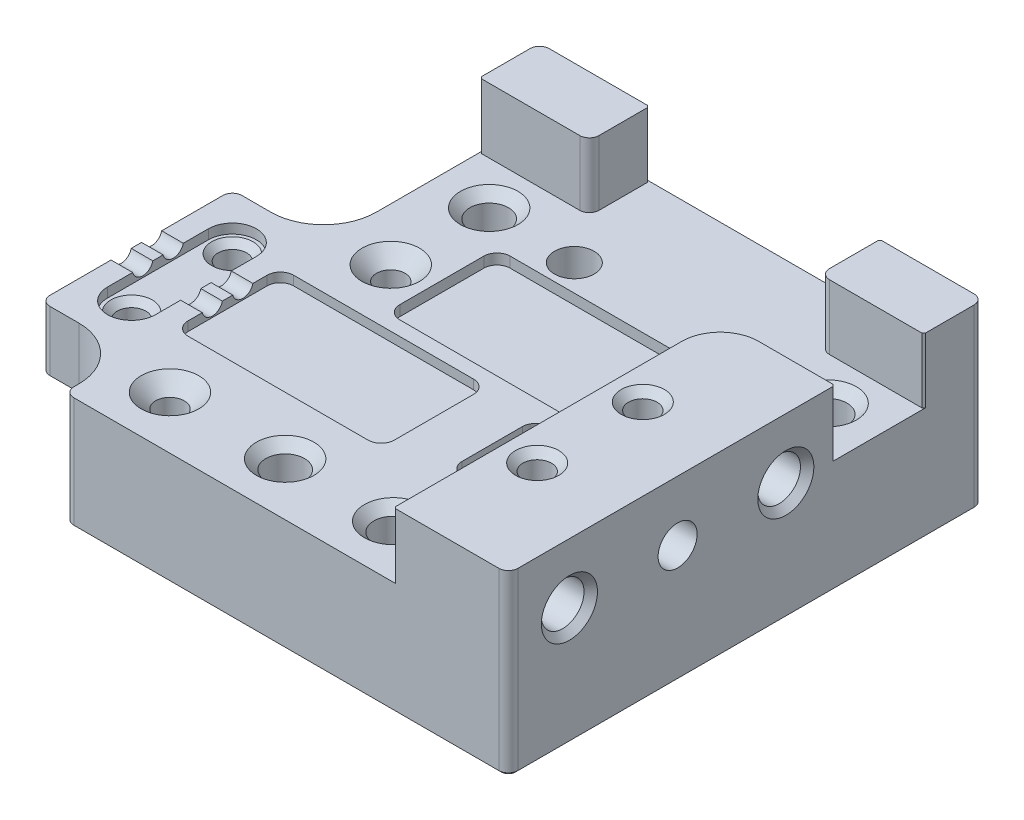
from build123d import *

# Parameters (mm, degrees)
SKETCH1_W                             = 22.3
SKETCH1_H                             = 19.8
BOSS_EXTRUDE1_DEPTH                   = 7.4
CUT_EXTRUDE8_DEPTH                    = 2.7
CUT_EXTRUDE6_DEPTH                    = 19.771652033
CUT_EXTRUDE6_DEPTH_BACK               = 19.771652033
SKETCH9_W                             = 9.6012
SKETCH9_H                             = 16.490065767
SKETCH9_W_2                           = 8.646091416
SKETCH9_H_2                           = 7.298316027
CUT_EXTRUDE2_DEPTH                    = 0.4364
CUT_EXTRUDE3_DEPTH                    = 0.387
CUT_EXTRUDE4_DEPTH                    = 0.387
CE_00_CLAMP_RELIEF_DEPTH              = 0.4
SKETCH50_W                            = 5.437865468
SKETCH50_H                            = 12.843757531
CE_00_CLAMP_UNDERCUT_DEPTH            = 2.2
F_0_80_TAPPED_HOLE_CLAMP_AT_2_COUNT   = 2
F_0_80_TAPPED_HOLE_CLAMP_AT_2_PITCH   = 4.2
F_0_COUNTERBORED_HOLE_D               = 1.651
F_0_COUNTERBORED_HOLE_CBORE_D         = 3
F_0_COUNTERBORED_HOLE_CBORE_DEPTH     = 2
F_0_80_TAPPED_HOLE2_AT_2_COUNT        = 2
F_0_80_TAPPED_HOLE2_AT_2_PITCH        = 9.2
F_52_0_0635_DIAMETER_HOLE2_AT_2_COUNT = 2
F_52_0_0635_DIAMETER_HOLE2_AT_2_PITCH = 4.5
F_0_CLEARANCE_HOLE2_AT_2_COUNT        = 2
F_0_CLEARANCE_HOLE2_AT_2_PITCH        = 14.1
F_0_80_TAPPED_HOLE7_AT_2_COUNT        = 2
F_0_80_TAPPED_HOLE7_AT_2_PITCH        = 4.4
F_2_56_TAPPED_HOLE1_D                 = 1.778
F_2_56_TAPPED_HOLE1_DEPTH             = 4
F_2_56_TAPPED_HOLE1_CSINK_D           = 2.3368
F_2_56_TAPPED_HOLE1_CSINK_ANGLE       = 90
F_2_56_TAPPED_HOLE1_TIP               = 0.53416509
F_1_0_1_DIAMETER_HOLE1_D              = 1
F_1_0_1_DIAMETER_HOLE1_DEPTH          = 5.4
F_1_0_1_DIAMETER_HOLE1_TIP            = 0.30043031
FILLET1_R                             = 0.4
FILLET2_R                             = 0.4
FILLET3_R                             = 2.2
CHAMFER_A_0_10MM_SIZE                 = 0.1
CHAMFER2_SIZE                         = 0.07


with BuildPart() as part:
    # Sketch1 → Boss-Extrude1 (new body)
    with BuildSketch(Plane(origin=(0, 0, 0), x_dir=(1, 0, 0), z_dir=(0, 1, 0))):
        with Locations((-1.5498, 3.1)):
            Rectangle(SKETCH1_W, SKETCH1_H)
    extrude(amount=BOSS_EXTRUDE1_DEPTH)

    # Sketch11 → Cut-Extrude8 (cut)
    with BuildSketch(Plane(origin=(0, 7.4, 0), x_dir=(1, 0, 0), z_dir=(0, 1, 0))):
        with BuildLine():
            Line((4.825, -17.149868936), (4.825, 5.2))
            ThreePointArc((4.825, 5.2), (5.29362915, 6.33137085), (6.425, 6.8))
            Line((6.425, 6.8), (15.917848471, 6.8))
            Line((15.917848471, 6.8), (15.917848471, 10.5))
            Line((15.917848471, 10.5), (5.2758, 10.5))
            Line((5.2758, 10.5), (5.2758, 15.119457422))
            Line((5.2758, 15.119457422), (-4.3254, 15.119457422))
            Line((-4.3254, 15.119457422), (-4.3254, 10.5))
            Line((-4.3254, 10.5), (-17.022656419, 10.5))
            Line((-17.022656419, 10.5), (-17.022656419, 3.556))
            Line((-17.022656419, 3.556), (-14.523625522, 3.556))
            ThreePointArc((-14.523625522, 3.556), (-14.099361454, 3.380264069), (-13.923625522, 2.956))
            Line((-13.923625522, 2.956), (-13.923625522, -7.02))
            ThreePointArc((-13.923625522, -7.02), (-14.099361454, -7.444264069), (-14.523625522, -7.62))
            Line((-14.523625522, -7.62), (-17.022656419, -7.62))
            Line((-17.022656419, -7.62), (-17.022656419, -17.149868936))
            Line((-17.022656419, -17.149868936), (4.825, -17.149868936))
        make_face()
    extrude(amount=-CUT_EXTRUDE8_DEPTH, mode=Mode.SUBTRACT)

    # Sketch9 → Cut-Extrude6 (cut, two sides: drawn at the far end of the back side and taken through both)
    with BuildSketch(Plane(origin=(0, 4.7, 0), x_dir=(1, 0, 0), z_dir=(0, 1, 0)).offset(-CUT_EXTRUDE6_DEPTH_BACK)):
        with Locations((-13.7004, 12.245032884)):
            Rectangle(SKETCH9_W, SKETCH9_H)
        with Locations((-13.222845708, -7.649158014)):
            Rectangle(SKETCH9_W_2, SKETCH9_H_2)
    extrude(amount=CUT_EXTRUDE6_DEPTH + CUT_EXTRUDE6_DEPTH_BACK, mode=Mode.SUBTRACT)

    # Sketch4 → Cut-Extrude2 (cut)
    with BuildSketch(Plane(origin=(0, 4.7, 0), x_dir=(1, 0, 0), z_dir=(0, 1, 0))):
        with BuildLine():
            Line((-5.075, 6.85), (-5.075, 3.35))
            ThreePointArc((-5.075, 3.35), (-4.91390873, 2.96109127), (-4.525, 2.8))
            Line((-4.525, 2.8), (4.275, 2.8))
            ThreePointArc((4.275, 2.8), (4.66390873, 2.96109127), (4.825, 3.35))
            Line((4.825, 3.35), (4.825, 6.85))
            ThreePointArc((4.825, 6.85), (4.66390873, 7.23890873), (4.275, 7.4))
            Line((4.275, 7.4), (-4.525, 7.4))
            ThreePointArc((-4.525, 7.4), (-4.91390873, 7.23890873), (-5.075, 6.85))
        make_face()
    extrude(amount=-CUT_EXTRUDE2_DEPTH, mode=Mode.SUBTRACT)

    # Sketch5 → Cut-Extrude3 (cut)
    with BuildSketch(Plane(origin=(0, 4.7, 0), x_dir=(1, 0, 0), z_dir=(0, 1, 0))):
        with BuildLine():
            Line((-8.35, 2.2), (-0.85, 2.2))
            ThreePointArc((-0.85, 2.2), (-0.46109127, 2.03890873), (-0.3, 1.65))
            Line((-0.3, 1.65), (-0.3, -1.65))
            ThreePointArc((-0.3, -1.65), (-0.46109127, -2.03890873), (-0.85, -2.2))
            Line((-0.85, -2.2), (-8.35, -2.2))
            ThreePointArc((-8.35, -2.2), (-8.73890873, -2.03890873), (-8.9, -1.65))
            Line((-8.9, -1.65), (-8.9, 1.65))
            ThreePointArc((-8.9, 1.65), (-8.73890873, 2.03890873), (-8.35, 2.2))
        make_face()
    extrude(amount=-CUT_EXTRUDE3_DEPTH, mode=Mode.SUBTRACT)

    # Sketch6 → Cut-Extrude4 (cut)
    with BuildSketch(Plane(origin=(0, 4.7, 0), x_dir=(1, 0, 0), z_dir=(0, 1, 0))):
        with BuildLine():
            Line((2.4286, 2.0534), (4.275, 2.0534))
            ThreePointArc((4.275, 2.0534), (4.66390873, 1.89230873), (4.825, 1.5034))
            Line((4.825, 1.5034), (4.825, -1.0034))
            ThreePointArc((4.825, -1.0034), (4.66390873, -1.39230873), (4.275, -1.5534))
            Line((4.275, -1.5534), (2.4286, -1.5534))
            ThreePointArc((2.4286, -1.5534), (2.03969127, -1.39230873), (1.8786, -1.0034))
            Line((1.8786, -1.0034), (1.8786, 1.5034))
            ThreePointArc((1.8786, 1.5034), (2.03969127, 1.89230873), (2.4286, 2.0534))
        make_face()
    extrude(amount=-CUT_EXTRUDE4_DEPTH, mode=Mode.SUBTRACT)

    # Sketch43 → CR-00 Input Coax Revolve (revolve, cut)
    with BuildSketch(Plane.XY.offset(-0.635)):
        with BuildLine():
            Line((-14.315428619, 4.3682), (-8.4998, 4.3682))
            ThreePointArc((-8.4998, 4.3682), (-8.194471292, 4.494671292), (-8.068, 4.8))
            Line((-8.068, 4.8), (-14.315428619, 4.8))
            Line((-14.315428619, 4.8), (-14.315428619, 4.3682))
        make_face()
    cr_00_input_coax_revolve = revolve(axis=Axis((-14.315428619, 4.8, -0.635), (-1, 0, 0)), mode=Mode.SUBTRACT)

    # MI-00 Input Coax Mirror: CR-00 Input Coax Revolve across plane
    add(cr_00_input_coax_revolve.mirror(Plane.XY), mode=Mode.SUBTRACT)

    # Sketch12 → CR-00 Output Hole & Sketch (revolve, cut)
    with BuildSketch(Plane(origin=(0, 4.9, 0), x_dir=(-1, 0, 0), z_dir=(0, 1, 0)), mode=Mode.PRIVATE) as cr_00_output_hole_sketch_sk:
        Polygon((-4.751793584, -0.25), (-11.196934048, -0.25), (-11.196934048, -1.012), (-10.196934048, -1.012), (-10.196934048, -0.9485), (-9.799934048, -0.9485), (-9.799934048, -1.0628), (-4.751793584, -1.0628), align=None)
    revolve(cr_00_output_hole_sketch_sk.sketch.rotate(Axis((11.196934048, 4.9, -0.25), (1, 0, 0)), 180), axis=Axis((11.196934048, 4.9, -0.25), (1, 0, 0)), mode=Mode.SUBTRACT)

    # Sketch46 → CE-00 Clamp Relief (cut)
    with BuildSketch(Plane(origin=(0, 4.7, 0), x_dir=(1, 0, 0), z_dir=(0, 1, 0))):
        with BuildLine():
            Line((-9.7998, -2.1), (-9.7998, 2.1))
            ThreePointArc((-9.7998, 2.1), (-10.7998, 3.1), (-11.7998, 2.1))
            Line((-11.7998, 2.1), (-11.7998, -2.1))
            ThreePointArc((-11.7998, -2.1), (-10.7998, -3.1), (-9.7998, -2.1))
        make_face()
    extrude(amount=-CE_00_CLAMP_RELIEF_DEPTH, mode=Mode.SUBTRACT)

    # Sketch50 → CE-00 Clamp Undercut (cut)
    with BuildSketch(Plane.XZ):
        with Locations((-11.618732734, 0.517149272)):
            Rectangle(SKETCH50_W, SKETCH50_H)
    extrude(amount=-CE_00_CLAMP_UNDERCUT_DEPTH, mode=Mode.SUBTRACT)

    # Sketch40 → #0-80 Tapped Hole Clamp (revolve, cut)
    with BuildSketch(Plane(origin=(-10.7998, 4.3, 2.1), x_dir=(0, 0, 1), z_dir=(1, 0, 0))):
        Polygon((0, 0), (0, 2.1), (1.000000032, 2.1), (0.59563, 1.695629968), (0.59563, 0.26797), (0.8636, 0), align=None)
    f_0_80_tapped_hole_clamp = revolve(axis=Axis((-10.7998, 10.65, 2.1), (0, -1, 0)), mode=Mode.SUBTRACT)

    # #0-80 Tapped Hole Clamp at 2: #0-80 Tapped Hole Clamp ×2
    with Locations(*[(0, 0, -i * F_0_80_TAPPED_HOLE_CLAMP_AT_2_PITCH) for i in range(1, F_0_80_TAPPED_HOLE_CLAMP_AT_2_COUNT)]):
        add(f_0_80_tapped_hole_clamp, mode=Mode.SUBTRACT)

    # #0 Counterbored Hole (through all)
    with Locations(Plane(origin=(3.077088049, 0, 3.306534169), x_dir=(1, 0, 0), z_dir=(0, -1, 0))):
        with Locations((0.827111951, -11.806534169), (-6.030888049, -11.806534169)):
            CounterBoreHole(F_0_COUNTERBORED_HOLE_D / 2, F_0_COUNTERBORED_HOLE_CBORE_D / 2, F_0_COUNTERBORED_HOLE_CBORE_DEPTH)

    # Sketch17 → #0-80 Tapped Hole2 (revolve, cut)
    with BuildSketch(Plane(origin=(-6.6998, 4.7, -4.6), x_dir=(0, 0, 1), z_dir=(1, 0, 0))):
        Polygon((0, 0), (0, 4.7), (1.000000032, 4.7), (0.59563, 4.295629968), (0.59563, 0.604370013), (1.200000013, 0), align=None)
    f_0_80_tapped_hole2 = revolve(axis=Axis((-6.6998, 11.05, -4.6), (0, -1, 0)), mode=Mode.SUBTRACT)

    # #0-80 Tapped Hole2 at 2: #0-80 Tapped Hole2 ×2
    with Locations(*[(0, 0, i * F_0_80_TAPPED_HOLE2_AT_2_PITCH) for i in range(1, F_0_80_TAPPED_HOLE2_AT_2_COUNT)]):
        add(f_0_80_tapped_hole2, mode=Mode.SUBTRACT)

    # Sketch19 → #52 (0.0635) Diameter Hole2 (revolve, cut)
    with BuildSketch(Plane(origin=(2.6002, 4.7, 4.6), x_dir=(0, 0, 1), z_dir=(1, 0, 0))):
        Polygon((0, 0), (0, 4.7), (1.000000032, 4.7), (0.80645, 4.506449968), (0.80645, 0.393550013), (1.200000013, 0), align=None)
    f_52_0_0635_diameter_hole2 = revolve(axis=Axis((2.6002, 11.05, 4.6), (0, -1, 0)), mode=Mode.SUBTRACT)

    # #52 (0.0635) Diameter Hole2 at 2: #52 (0.0635) Diameter Hole2 ×2
    with Locations(*[(-i * F_52_0_0635_DIAMETER_HOLE2_AT_2_PITCH, 0, 0) for i in range(1, F_52_0_0635_DIAMETER_HOLE2_AT_2_COUNT)]):
        add(f_52_0_0635_diameter_hole2, mode=Mode.SUBTRACT)

    # Sketch21 → #0 Clearance Hole2 (revolve, cut)
    with BuildSketch(Plane(origin=(7.4002, 4.7, -8.7), x_dir=(0, 0, 1), z_dir=(1, 0, 0))):
        Polygon((0, 0), (0, 4.7), (1.000000032, 4.7), (0.80645, 4.506449968), (0.80645, 0.393550013), (1.200000013, 0), align=None)
    f_0_clearance_hole2 = revolve(axis=Axis((7.4002, 11.05, -8.7), (0, -1, 0)), mode=Mode.SUBTRACT)

    # #0 Clearance Hole2 at 2: #0 Clearance Hole2 ×2
    with Locations(*[(-i * F_0_CLEARANCE_HOLE2_AT_2_PITCH, 0, 0) for i in range(1, F_0_CLEARANCE_HOLE2_AT_2_COUNT)]):
        add(f_0_clearance_hole2, mode=Mode.SUBTRACT)

    # Sketch28 → #0-80 Tapped Hole7 (revolve, cut)
    with BuildSketch(Plane(origin=(6.2002, 7.4, 2.2), x_dir=(0, 0, 1), z_dir=(1, 0, 0))):
        Polygon((0, 0), (0, 7.4), (1.000000032, 7.4), (0.59563, 6.995629968), (0.59563, 0.304369978), (0.899999978, 0), align=None)
    f_0_80_tapped_hole7 = revolve(axis=Axis((6.2002, 13.75, 2.2), (0, -1, 0)), mode=Mode.SUBTRACT)

    # #0-80 Tapped Hole7 at 2: #0-80 Tapped Hole7 ×2
    with Locations(*[(0, 0, -i * F_0_80_TAPPED_HOLE7_AT_2_PITCH) for i in range(1, F_0_80_TAPPED_HOLE7_AT_2_COUNT)]):
        add(f_0_80_tapped_hole7, mode=Mode.SUBTRACT)

    # #2-56 Tapped Hole1
    with Locations(Plane(origin=(9.6002, 0, 0), x_dir=(0, 0, -1), z_dir=(1, 0, 0))):
        with Locations((4.7585, 4.9), (-4.2585, 4.9)):
            CounterSinkHole(F_2_56_TAPPED_HOLE1_D / 2, F_2_56_TAPPED_HOLE1_CSINK_D / 2, depth=F_2_56_TAPPED_HOLE1_DEPTH, counter_sink_angle=F_2_56_TAPPED_HOLE1_CSINK_ANGLE)
            with Locations((0, 0, -(F_2_56_TAPPED_HOLE1_DEPTH + F_2_56_TAPPED_HOLE1_TIP / 2))):  # 118° drill point
                Cone(0, F_2_56_TAPPED_HOLE1_D / 2, F_2_56_TAPPED_HOLE1_TIP, mode=Mode.SUBTRACT)

    # Ø1.0 (1) Diameter Hole1
    with Locations(Plane(origin=(9.6002, 0, 0), x_dir=(0, 0, -1), z_dir=(1, 0, 0))):
        with Locations((4.7585, 4.9), (-4.2585, 4.9)):
            Hole(F_1_0_1_DIAMETER_HOLE1_D / 2, depth=F_1_0_1_DIAMETER_HOLE1_DEPTH)
            with Locations((0, 0, -(F_1_0_1_DIAMETER_HOLE1_DEPTH + F_1_0_1_DIAMETER_HOLE1_TIP / 2))):  # 118° drill point
                Cone(0, F_1_0_1_DIAMETER_HOLE1_D / 2, F_1_0_1_DIAMETER_HOLE1_TIP, mode=Mode.SUBTRACT)

    # Fillet1
    fillet1_edges = [part.edges().sort_by_distance(p)[0] for p in [
        (-12.6998, 3.45, 4),
        (-12.6998, 3.45, -4),
    ]]
    fillet(fillet1_edges, radius=FILLET1_R)

    # Fillet2
    fillet2_edges = [part.edges().sort_by_distance(p)[0] for p in [
        (-4.3254, 6.05, -10.5),
        (5.2758, 6.05, -10.5),
        (9.6002, 3.7, -13),
        (-8.8998, 2.35, 6.8),
        (9.6002, 3.7, 6.8),
        (-8.8998, 3.7, -13),
    ]]
    fillet(fillet2_edges, radius=FILLET2_R)

    # Fillet3
    fillet3_edges = [part.edges().sort_by_distance(p)[0] for p in [
        (-8.8998, 3.45, -4),
        (-8.8998, 3.45, 4),
    ]]
    fillet(fillet3_edges, radius=FILLET3_R)

    # Chamfer A 0.10mm
    chamfer_a_0_10mm_edges = [part.edges().sort_by_distance(p)[0] for p in [
        (0.3502, 0, -13),
        (-8.8998, 0, -3.1),
        (9.6002, 0, -3.1),
        (0.3502, 0, 6.8),
        (-8.782642712, 0, 6.682842712),
        (9.483042712, 0, 6.682842712),
        (9.483042712, 0, -12.882842712),
        (-8.782642712, 0, -12.882842712),
    ]]
    chamfer(chamfer_a_0_10mm_edges, length=CHAMFER_A_0_10MM_SIZE)

    # Chamfer2
    chamfer2_edges = [part.edges().sort_by_distance(p)[0] for p in [
        (-4.3254, 6.05, -13),
        (5.2758, 6.05, -13),
        (9.6002, 6.05, -10.5),
        (9.6002, 6.05, -6.8),
        (4.825, 6.05, 6.8),
        (-8.8998, 6.05, -10.5),
    ]]
    chamfer(chamfer2_edges, length=CHAMFER2_SIZE)


solid = part.part
